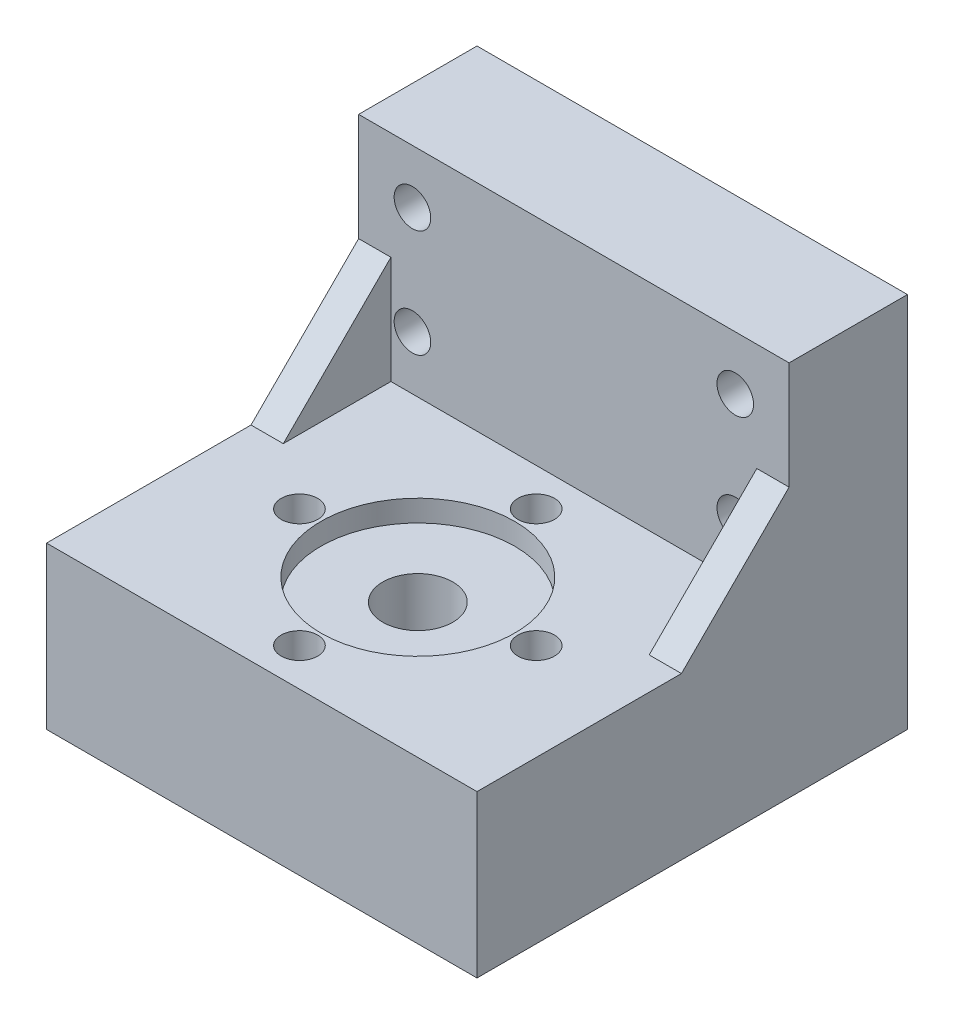
from build123d import *

# Parameters (mm, degrees)
BOSS_EXTRUDE1_DEPTH = 40
SKETCH2_R           = 9
CUT_EXTRUDE8_DEPTH  = 2
SKETCH6_R           = 3.25
CUT_EXTRUDE9_DEPTH  = 61.695963622
SKETCH7_R           = 1.7
CUT_EXTRUDE10_DEPTH = 61
SKETCH8_R           = 1.7
CUT_EXTRUDE11_DEPTH = 61.547502013
BOSS_EXTRUDE3_DEPTH = 3


with BuildPart() as part:
    # Sketch1 → Boss-Extrude1 (new body)
    with BuildSketch(Plane(origin=(0, 0, 0), x_dir=(0, 0, -1), z_dir=(1, 0, 0))):
        Polygon((0, 0), (40, 0), (40, 15), (40, 35), (29, 35), (29, 15), (0, 15), align=None)
    extrude(amount=BOSS_EXTRUDE1_DEPTH)

    # Sketch2 → Cut-Extrude8 (cut)
    with BuildSketch(Plane(origin=(0, 15, 0), x_dir=(1, 0, 0), z_dir=(0, 1, 0))):
        with Locations(Location((20, 14.5, 0), (0, 0, 270))):
            Circle(SKETCH2_R)
    extrude(amount=-CUT_EXTRUDE8_DEPTH, mode=Mode.SUBTRACT)

    # Sketch6 → Cut-Extrude9 (cut, through all)
    with BuildSketch(Plane(origin=(0, 13, 0), x_dir=(1, 0, 0), z_dir=(0, 1, 0))):
        with Locations(Location((20, 14.5, 0), (0, 0, 270))):
            Circle(SKETCH6_R)
    extrude(amount=-CUT_EXTRUDE9_DEPTH, mode=Mode.SUBTRACT)

    # Sketch7 → Cut-Extrude10 (cut, through all)
    with BuildSketch(Plane(origin=(0, 15, 0), x_dir=(1, 0, 0), z_dir=(0, 1, 0))):
        with Locations(Location((31, 14.5, 0), (0, 0, 270))):
            Circle(SKETCH7_R)
        with Locations(Location((20, 25.5, 0), (0, 0, 270))):
            Circle(SKETCH7_R)
        with Locations(Location((9, 14.5, 0), (0, 0, 270))):
            Circle(SKETCH7_R)
        with Locations(Location((20, 3.5, 0), (0, 0, 270))):
            Circle(SKETCH7_R)
    extrude(amount=-CUT_EXTRUDE10_DEPTH, mode=Mode.SUBTRACT)

    # Sketch8 → Cut-Extrude11 (cut, through all)
    with BuildSketch(Plane.XY.offset(-29)):
        with Locations((35, 30)):
            Circle(SKETCH8_R)
        with Locations((35, 20)):
            Circle(SKETCH8_R)
        with Locations((5, 30)):
            Circle(SKETCH8_R)
        with Locations((5, 20)):
            Circle(SKETCH8_R)
    extrude(amount=-CUT_EXTRUDE11_DEPTH, mode=Mode.SUBTRACT)

    # Sketch9 → Boss-Extrude3 (add)
    with BuildSketch(Plane(origin=(40, 0, 0), x_dir=(0, 0, -1), z_dir=(1, 0, 0))):
        Polygon((29, 25), (29, 15), (19, 15), align=None)
    boss_extrude3 = extrude(amount=-BOSS_EXTRUDE3_DEPTH)

    # Mirror3: Boss-Extrude3 across plane
    add(boss_extrude3.mirror(Plane.ZY.offset(-20)))


solid = part.part
